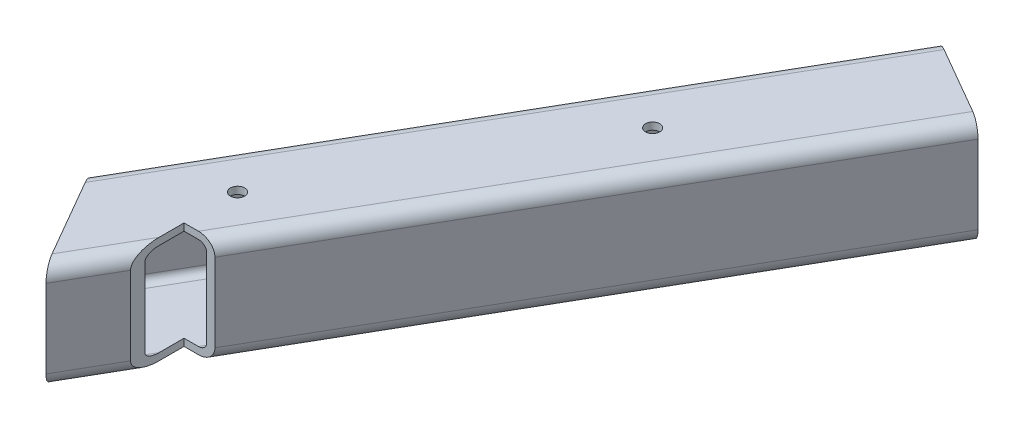
from build123d import *

# Parameters (mm, degrees)
EXTRUDE_1_DEPTH          = 200
CUT_EXTRUDE_1_DEPTH      = 193.621587163
CUT_EXTRUDE_1_DEPTH_BACK = 193.621587163
CUT_EXTRUDE_2_DEPTH      = 192.309050473
CUT_EXTRUDE_2_DEPTH_BACK = 192.309050473
SKETCH_8_R               = 2
CUT_EXTRUDE_3_DEPTH      = 192.309050473
CUT_EXTRUDE_3_DEPTH_BACK = 192.309050473
SKETCH_9_W               = 52
SKETCH_9_H               = 25


with BuildPart() as part:
    # 草图5 → 凸台-拉伸1 (new body)
    with BuildSketch(Plane(origin=(-52, 0, 0), x_dir=(-0.8660254037844397, 0, -0.4999999999999983), z_dir=(0.4999999999999982, 0, -0.8660254037844396))):
        with BuildLine():
            Line((-11, -15), (11, -15))
            ThreePointArc((11, -15), (13.828427125, -13.828427125), (15, -11))
            Line((15, -11), (15, 11))
            ThreePointArc((15, 11), (13.828427125, 13.828427125), (11, 15))
            Line((11, 15), (-11, 15))
            ThreePointArc((-11, 15), (-13.828427125, 13.828427125), (-15, 11))
            Line((-15, 11), (-15, -11))
            ThreePointArc((-15, -11), (-13.828427125, -13.828427125), (-11, -15))
        make_face()
        with BuildLine():
            Line((-11, -13), (11, -13))
            ThreePointArc((11, -13), (12.414213562, -12.414213562), (13, -11))
            Line((13, -11), (13, 11))
            ThreePointArc((13, 11), (12.414213562, 12.414213562), (11, 13))
            Line((11, 13), (-11, 13))
            ThreePointArc((-11, 13), (-12.414213562, 12.414213562), (-13, 11))
            Line((-13, 11), (-13, -11))
            ThreePointArc((-13, -11), (-12.414213562, -12.414213562), (-11, -13))
        make_face(mode=Mode.SUBTRACT)
    extrude(amount=EXTRUDE_1_DEPTH)

    # 草图7 → 切除-拉伸1 (cut, two sides: drawn at the far end of the back side and taken through both)
    with BuildSketch(Plane(origin=(0, 0, 0), x_dir=(1, 0, 0), z_dir=(0, 1, 0)).offset(-CUT_EXTRUDE_1_DEPTH_BACK)):
        Polygon((2.851111613, -65.004912165), (-65.527886261, 53.430986323), (-91.508648375, 38.430986323), (-23.129650501, -80.004912165), align=None)
    extrude(amount=CUT_EXTRUDE_1_DEPTH + CUT_EXTRUDE_1_DEPTH_BACK, mode=Mode.SUBTRACT)

    # 草图8 → 切除-拉伸2 (cut, two sides: drawn at the far end of the back side and taken through both)
    with BuildSketch(Plane(origin=(0, 0, 0), x_dir=(1, 0, 0), z_dir=(0, 1, 0)).offset(-CUT_EXTRUDE_2_DEPTH_BACK)):
        with Locations(Location((-26, 45.033320997, 0), (0, 0, 270))):
            Circle(SKETCH_8_R)
        with Locations(Location((16.614746246, 118.844226646, 0), (0, 0, 270))):
            Circle(SKETCH_8_R)
    extrude(amount=CUT_EXTRUDE_2_DEPTH + CUT_EXTRUDE_2_DEPTH_BACK, mode=Mode.SUBTRACT)

    # 草图9 → 切除-拉伸3 (cut, two sides: drawn at the far end of the back side and taken through both)
    with BuildSketch(Plane(origin=(0, 0, 0), x_dir=(1, 0, 0), z_dir=(0, 1, 0)).offset(-CUT_EXTRUDE_3_DEPTH_BACK)):
        with Locations((0, 17.533320997)):
            Rectangle(SKETCH_9_W, SKETCH_9_H)
    extrude(amount=CUT_EXTRUDE_3_DEPTH + CUT_EXTRUDE_3_DEPTH_BACK, mode=Mode.SUBTRACT)


solid = part.part
